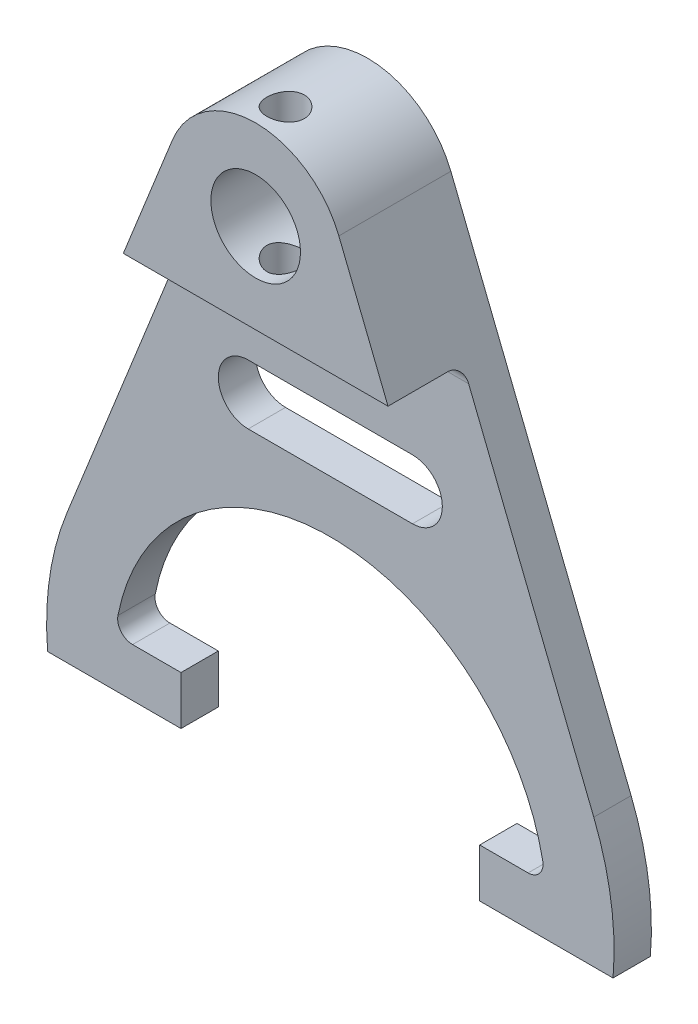
from build123d import *

# Parameters (mm, degrees)
ESTRUSIONE_ESTRUSIONE1_DEPTH = 5
ESTRUSIONE_ESTRUSIONE2_DEPTH = 10
RACCORDO1_R                  = 2
FORO_12_0_12_1_D             = 12
FORO_5_0_5_2_D               = 5
TAGLIO_ESTRUSIONE1_REACH     = 85.124


with BuildPart() as part:
    # Schizzo2 → Estrusione-Estrusione1 (new body)
    with BuildSketch(Plane.XY):
        with BuildLine():
            ThreePointArc((11.141538384, 4.457142857), (0, 12), (-11.141538384, 4.457142857))
            Line((-11.141538384, 4.457142857), (-35.281538214, -55.885714286))
            ThreePointArc((-35.281538214, -55.885714286), (-37.314196039, -62.813152713), (-38, -70))
            ThreePointArc((-38, -70), (-37.965175205, -71.626490584), (-37.860764652, -73.25))
            Line((-37.860764652, -73.25), (-20, -73.25))
            Line((-20, -73.25), (-20, -66.75))
            Line((-20, -66.75), (-28.817312505, -66.75))
            ThreePointArc((-28.817312505, -66.75), (0, -41), (28.817312505, -66.75))
            Line((28.817312505, -66.75), (20, -66.75))
            Line((20, -66.75), (20, -73.25))
            Line((20, -73.25), (37.860764652, -73.25))
            ThreePointArc((37.860764652, -73.25), (37.965175205, -71.626490584), (38, -70))
            ThreePointArc((38, -70), (37.314196039, -62.813152713), (35.281538214, -55.885714286))
            Line((35.281538214, -55.885714286), (11.141538384, 4.457142857))
        make_face()
    extrude(amount=ESTRUSIONE_ESTRUSIONE1_DEPTH)

    # Schizzo3 → Estrusione-Estrusione2 (add)
    with BuildSketch(Plane.XY.offset(5)):
        with BuildLine():
            Line((-17.725174701, -12), (17.725174701, -12))
            Line((17.725174701, -12), (11.141538384, 4.457142857))
            ThreePointArc((11.141538384, 4.457142857), (0, 12), (-11.141538384, 4.457142857))
            Line((-11.141538384, 4.457142857), (-17.725174701, -12))
        make_face()
    extrude(amount=ESTRUSIONE_ESTRUSIONE2_DEPTH)

    # Raccordo1
    raccordo1_edges = [part.edges().sort_by_distance(p)[0] for p in [
        (-28.817312505, -66.75, 2.5),
        (28.817312505, -66.75, 2.5),
        (0, -12, 5),
    ]]
    fillet(raccordo1_edges, radius=RACCORDO1_R)

    # Foro Ø12.0 (12)-1 (through all)
    with Locations(Plane.XY.offset(15)):
        with Locations((0, 0)):
            Hole(FORO_12_0_12_1_D / 2)

    # Foro Ø5.0 (5)-2 (through all)
    with Locations(Plane(origin=(0, -12, 0), x_dir=(-1, 0, 0), z_dir=(0, -1, 0))):
        with Locations((0, -11)):
            Hole(FORO_5_0_5_2_D / 2)

    # Schizzo8 → Taglio-Estrusione1 (cut, up to next)
    with BuildSketch(Plane.XY.offset(5), mode=Mode.PRIVATE) as taglio_estrusione1_sk1:
        with BuildLine():
            Line((-11, -26), (11, -26))
            ThreePointArc((11, -26), (15, -30), (11, -34))
            Line((11, -34), (-11, -34))
            ThreePointArc((-11, -34), (-15, -30), (-11, -26))
        make_face()
    taglio_estrusione1_tool1 = extrude(taglio_estrusione1_sk1.sketch, amount=-TAGLIO_ESTRUSIONE1_REACH, mode=Mode.PRIVATE) & part.part
    add(taglio_estrusione1_tool1.solids().sort_by_distance((0, -30, 5))[0], mode=Mode.SUBTRACT)


solid = part.part
